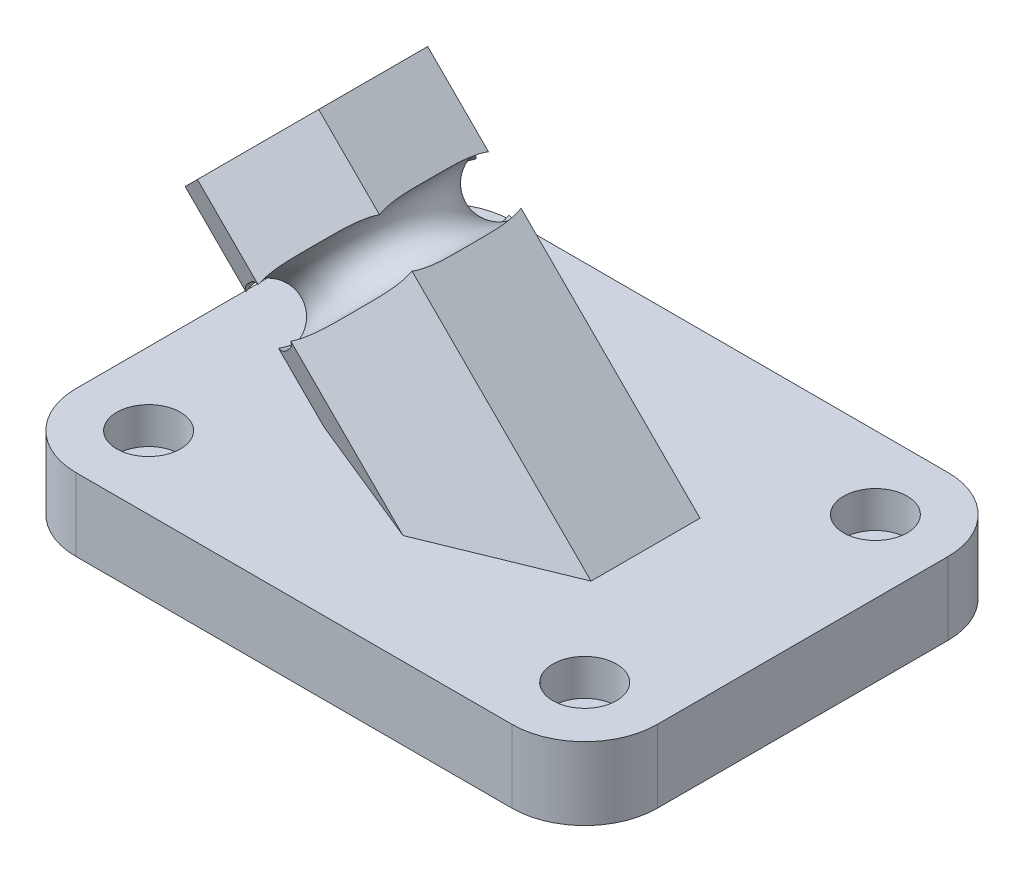
from build123d import *

# Parameters (mm, degrees)
BOSS_EXTRUDE1_DEPTH                                 = 12.7
CBORE_FOR_00_BINDING_HEAD_MACHINE_SCREW_D           = 6.7564
CBORE_FOR_00_BINDING_HEAD_MACHINE_SCREW_CBORE_D     = 11.1252
CBORE_FOR_00_BINDING_HEAD_MACHINE_SCREW_CBORE_DEPTH = 6.35
BOSS_EXTRUDE2_DEPTH                                 = 50.8
BOSS_EXTRUDE2_DEPTH_BACK                            = 50.8
SKETCH10_R                                          = 4.7752
SKETCH11_R                                          = 7.9375
CUT_EXTRUDE1_DEPTH                                  = 148.399953238


with BuildPart() as part:
    # Sketch1 → Boss-Extrude1 (new body)
    with BuildSketch(Plane(origin=(0, 0, 0), x_dir=(1, 0, 0), z_dir=(0, 1, 0))):
        with BuildLine():
            Line((12.7, 0), (88.9, 0))
            ThreePointArc((88.9, 0), (97.880256121, 3.719743879), (101.6, 12.7))
            Line((101.6, 12.7), (101.6, 63.5))
            ThreePointArc((101.6, 63.5), (97.880256121, 72.480256121), (88.9, 76.2))
            Line((88.9, 76.2), (12.7, 76.2))
            ThreePointArc((12.7, 76.2), (3.719743879, 72.480256121), (0, 63.5))
            Line((0, 63.5), (0, 12.7))
            ThreePointArc((0, 12.7), (3.719743879, 3.719743879), (12.7, 0))
        make_face()
    extrude(amount=BOSS_EXTRUDE1_DEPTH)

    # CBORE for #00 Binding Head Machine Screw1 (through all)
    with Locations(Plane(origin=(12.7, 12.7, -12.7), x_dir=(0, 0, 1), z_dir=(0, 1, 0))):
        with Locations((0, 0), (0, 76.2), (-50.8, 76.2), (-50.8, 0)):
            CounterBoreHole(CBORE_FOR_00_BINDING_HEAD_MACHINE_SCREW_D / 2, CBORE_FOR_00_BINDING_HEAD_MACHINE_SCREW_CBORE_D / 2, CBORE_FOR_00_BINDING_HEAD_MACHINE_SCREW_CBORE_DEPTH)


with BuildPart() as body_2:
    # Sketch7 → Boss-Extrude2 (new, two sides: drawn at the far end of the back side and taken through both)
    with BuildSketch(Plane(origin=(19.05, -19.05, 0), x_dir=(0, 0, 1), z_dir=(-0.7071067811865488, 0.7071067811865464, 0)).offset(-BOSS_EXTRUDE2_DEPTH_BACK)):
        Polygon((-57.15, 44.901280605), (-47.625, 28.403496663), (-28.575, 28.403496663), (-19.05, 44.901280605), (-28.575, 61.399064547), (-47.625, 61.399064547), align=None)
    extrude(amount=BOSS_EXTRUDE2_DEPTH + BOSS_EXTRUDE2_DEPTH_BACK)

    # SurfaceCut16: cut with a surface, the side behind it stays
    # Surface-Offset1: a surface, a copy of 1 face of the part
    surface_offset1_1 = part.part.faces().sort_by_distance((50.8, 0, -38.1))[0]
    split(bisect_by=surface_offset1_1, keep=Keep.BOTTOM)

    # Sketch10 → Cut-Revolve1 (revolve, cut)
    with BuildSketch(Plane(origin=(0, 0, -38.1), x_dir=(-1, 0, 0), z_dir=(0, 0, -1)), mode=Mode.PRIVATE) as cut_revolve1_sk:
        with Locations((-40.015054597, 46.816335203)):
            Circle(SKETCH10_R)
    revolve(cut_revolve1_sk.sketch.rotate(Axis((14.878975516, 48.621024484, -38.1), (0.7071067811865499, -0.7071067811865451, 0)), 150.000000006), axis=Axis((14.878975516, 48.621024484, -38.1), (0.7071067811865499, -0.7071067811865451, 0)), mode=Mode.SUBTRACT)


with BuildPart() as cut_extrude1_tool:
    # Sketch11 → Cut-Extrude1 (new, through all)
    with BuildSketch(Plane(origin=(-16.871024484, 16.871024484, 0), x_dir=(0, 0, 1), z_dir=(-0.7071067811865488, 0.7071067811865462, 0))):
        with Locations(Location((-38.1, 44.901280605, 0), (0, 0, 270))):
            Circle(SKETCH11_R)
    extrude(amount=-CUT_EXTRUDE1_DEPTH)


with BuildPart() as part_1:
    add(part.part)

    # Cut-Extrude1: cut by cut_extrude1_tool
    add(cut_extrude1_tool.part, mode=Mode.SUBTRACT)


with BuildPart() as body_2_1:
    add(body_2.part)

    # Cut-Extrude1: cut by cut_extrude1_tool
    add(cut_extrude1_tool.part, mode=Mode.SUBTRACT)


with BuildPart() as part_2:
    add(part_1.part)

    # Combine1: union body 2
    add(body_2_1.part)


solid = part_2.part
